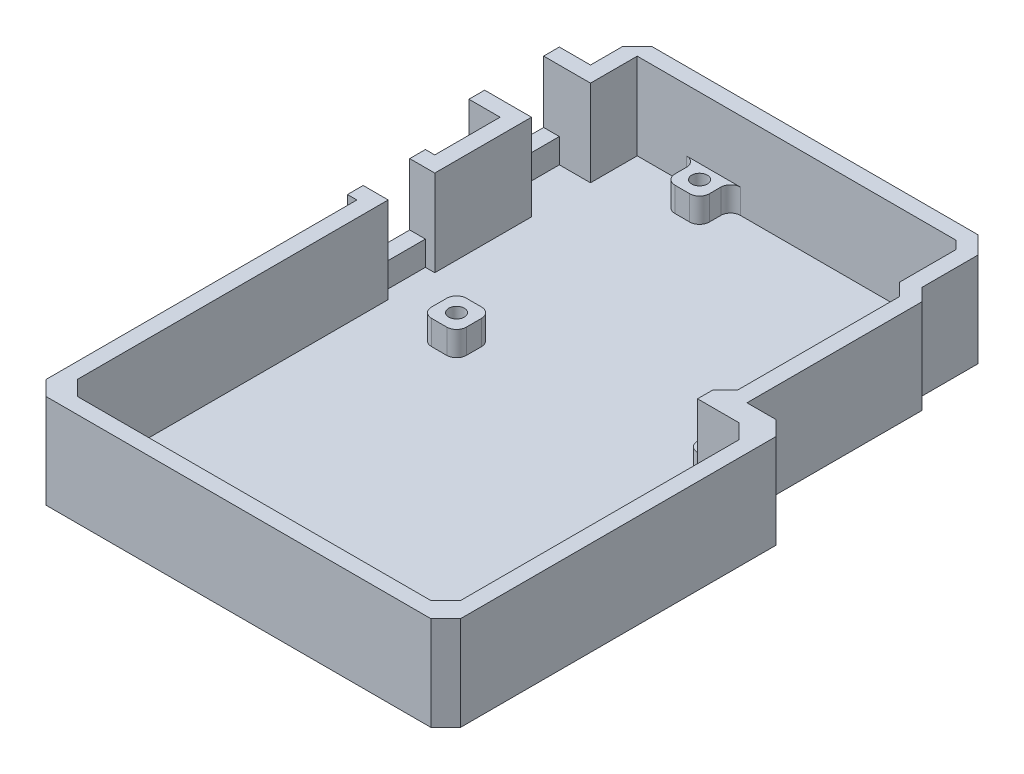
from build123d import *

# Parameters (mm, degrees)
BOSS_EXTRUDE1_DEPTH = 1.600000102
BOSS_EXTRUDE2_START = 1.6
BOSS_EXTRUDE2_DEPTH = 17.599999852
SKETCH7_W           = 6.999999716
SKETCH7_H           = 6.999999716
SKETCH7_W_2         = 9.650966474
SKETCH7_H_2         = 9.900528062
SKETCH7_H_3         = 10.408528062
SKETCH7_W_3         = 7.09362233
SKETCH7_H_4         = 7.09362233
BOSS_EXTRUDE4_DEPTH = 4.999999906
SKETCH2_R           = 1.5875
CUT_EXTRUDE3_DEPTH  = 107.667181296
SKETCH6_W           = 9.489999816
SKETCH6_H           = 12.599999946
SKETCH6_W_2         = 12.029999816
CUT_EXTRUDE1_DEPTH  = 7.64499995
FILLET1_R           = 2.000000064
CHAMFER2_SIZE       = 3
CUT_EXTRUDE6_DEPTH  = 2.50000008


with BuildPart() as part:
    # Sketch3 → Boss-Extrude1 (new body)
    with BuildSketch(Plane(origin=(0, 0, 0), x_dir=(1, 0, 0), z_dir=(0, 1, 0))):
        Polygon((72.079999858, 3.630252591), (80.996034335, 3.630252591), (80.996034335, -66.69999995), (-3.483453186, -66.69999995), (-3.483453186, -0.324999858), (-5.404999858, -0.324999858), (-5.404999858, 15.564999858), (-3.499999858, 15.564999858), (-3.499999858, 28.885000142), (-9.849999858, 28.885000142), (-9.849999858, 47.314999858), (-3.499999858, 47.314999858), (-3.499999858, 56.839999858), (65.965747409, 56.839999858), (69.539999858, 53.265747409), (69.539999858, 41.835747409), (72.079999858, 39.295747409), align=None)
    extrude(amount=BOSS_EXTRUDE1_DEPTH)

    # Sketch3<3> → Boss-Extrude2 (add)
    with BuildSketch(Plane(origin=(0, 0, 0), x_dir=(1, 0, 0), z_dir=(0, 1, 0)).offset(BOSS_EXTRUDE2_START)):
        Polygon((72.079999858, 3.630252591), (80.996034335, 3.630252591), (80.996034335, -66.69999995), (-3.483453186, -66.69999995), (-3.483453186, -0.324999858), (-5.404999858, -0.324999858), (-5.404999858, 15.564999858), (-3.499999858, 15.564999858), (-3.499999858, 28.885000142), (-9.849999858, 28.885000142), (-9.849999858, 47.314999858), (-3.499999858, 47.314999858), (-3.499999858, 56.839999858), (65.965747409, 56.839999858), (69.539999858, 53.265747409), (69.539999858, 41.835747409), (72.079999858, 39.295747409), align=None)
        Polygon((77.796034385, -0.705067354), (77.796034385, -63.5), (-0.299999908, -63.5), (-0.299999908, 0), (-0.299999908, 2.875000092), (-2.204999908, 2.875000092), (-2.204999908, 12.364999908), (-0.299999908, 12.364999908), (-0.299999908, 32.085000092), (-6.649999908, 32.085000092), (-6.649999908, 44.114999908), (-0.299999908, 44.114999908), (-0.299999908, 53.639999908), (64.640264031, 53.639999908), (66.339999908, 51.940264031), (66.339999908, 40.510264031), (68.879999908, 37.970264031), (68.879999908, 4.955735969), (66.339999908, 2.415735969), (66.339999908, 0), (66.339999908, -0.705067354), align=None, mode=Mode.SUBTRACT)
    extrude(amount=BOSS_EXTRUDE2_DEPTH)

    # Sketch7 → Boss-Extrude4 (add)
    with BuildSketch(Plane(origin=(0, 1.600000102, 0), x_dir=(1, 0, 0), z_dir=(0, 1, 0))):
        with Locations((15.24, 50.8)):
            Rectangle(SKETCH7_W, SKETCH7_H)
        with Locations((66.04, 35.56)):
            Rectangle(SKETCH7_W_2, SKETCH7_H_2)
        with Locations((66.04, 7.62)):
            Rectangle(SKETCH7_W_2, SKETCH7_H_3)
        with Locations((13.97, 2.54)):
            Rectangle(SKETCH7_W_3, SKETCH7_H_4)
    extrude(amount=BOSS_EXTRUDE4_DEPTH)

    # Sketch2 → Cut-Extrude3 (cut, through all)
    with BuildSketch(Plane(origin=(0, 0, 0), x_dir=(1, 0, 0), z_dir=(0, 1, 0))):
        with Locations(Location((13.97, 2.54, 0), (0, 0, 90))):
            Circle(SKETCH2_R)
        with Locations(Location((15.24, 50.8, 0), (0, 0, 270))):
            Circle(SKETCH2_R)
        with Locations(Location((66.04, 35.56, 0), (0, 0, 90))):
            Circle(SKETCH2_R)
        with Locations(Location((66.04, 7.62, 0), (0, 0, 270))):
            Circle(SKETCH2_R)
    extrude(amount=CUT_EXTRUDE3_DEPTH, mode=Mode.SUBTRACT)

    # Sketch6 → Cut-Extrude1 (cut)
    with BuildSketch(Plane(origin=(-2.204999908, 0, 0), x_dir=(0, 0, -1), z_dir=(1, 0, 0))):
        with Locations((7.62, 12.899999981)):
            Rectangle(SKETCH6_W, SKETCH6_H)
        with Locations((38.1, 12.899999981)):
            Rectangle(SKETCH6_W_2, SKETCH6_H)
    extrude(amount=-CUT_EXTRUDE1_DEPTH, mode=Mode.SUBTRACT)

    # Fillet1
    fillet1_edges = [part.edges().sort_by_distance(p)[0] for p in [
        (11.740000142, 4.100000055, -53.639999908),
        (18.739999858, 4.100000055, -53.639999908),
        (18.739999858, 4.100000055, -47.300000142),
        (11.740000142, 4.100000055, -47.300000142),
        (66.339999908, 4.100000004, -40.510264031),
        (68.879999908, 4.100000055, -30.609735969),
        (61.214516763, 4.100000055, -30.609735969),
        (61.214516763, 4.100000055, -40.510264031),
        (66.339999908, 4.100000004, -2.415735969),
        (68.879999908, 4.100000055, -12.824264031),
        (61.214516763, 4.100000055, -2.415735969),
        (61.214516763, 4.100000055, -12.824264031),
        (10.423188835, 4.100000055, -6.086811165),
        (10.423188835, 4.100000055, 1.006811165),
        (17.516811165, 4.100000055, 1.006811165),
        (17.516811165, 4.100000055, -6.086811165),
    ]]
    fillet(fillet1_edges, radius=FILLET1_R)

    # Chamfer2
    chamfer2_edges = [part.edges().sort_by_distance(p)[0] for p in [
        (-3.499999858, 9.599999926, -56.839999858),
        (80.996034335, 9.599999926, -3.630252591),
        (80.996034335, 9.599999926, 66.69999995),
        (-3.483453186, 9.599999926, 66.69999995),
        (-0.299999908, 10.399999926, 63.5),
        (77.796034385, 10.399999926, 63.5),
        (77.796034385, 10.399999926, 0.705067354),
    ]]
    chamfer(chamfer2_edges, length=CHAMFER2_SIZE)

    # Sketch15 → Cut-Extrude6 (cut)
    with BuildSketch(Plane.XZ):
        Polygon((13.97, 0.60655898), (11.244999989, -0.96672051), (11.244999989, -4.11327949), (13.97, -5.68655898), (16.695000011, -4.11327949), (16.695000011, -0.96672051), align=None)
        Polygon((66.04, -4.47344102), (63.314999989, -6.04672051), (63.314999989, -9.19327949), (66.04, -10.76655898), (68.765000011, -9.19327949), (68.765000011, -6.04672051), align=None)
        Polygon((66.04, -32.41344102), (63.314999989, -33.98672051), (63.314999989, -37.13327949), (66.04, -38.70655898), (68.765000011, -37.13327949), (68.765000011, -33.98672051), align=None)
        Polygon((15.24, -47.65344102), (12.514999989, -49.22672051), (12.514999989, -52.37327949), (15.24, -53.94655898), (17.965000011, -52.37327949), (17.965000011, -49.22672051), align=None)
    extrude(amount=-CUT_EXTRUDE6_DEPTH, mode=Mode.SUBTRACT)


solid = part.part
